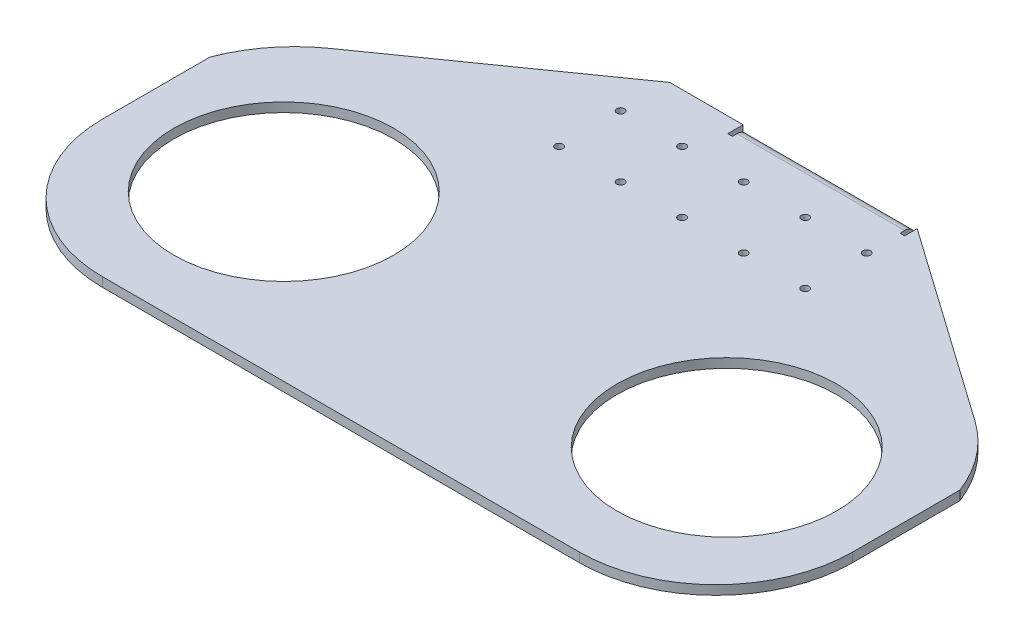
from build123d import *

# Parameters (mm, degrees)
EXTRUDE_1_DEPTH         = 3
SKETCH_2_W              = 1.5
SKETCH_2_H              = 5
CUT_EXTRUDE_1_DEPTH     = 154.658257181
SKETCH_3_W              = 54.5
SKETCH_3_H              = 3
EXTRUDE_2_DEPTH         = 40
HOLE_WIZARD_2_5_2_5_1_D = 2.5
HOLE_WIZARD_2_5_2_5_2_D = 2.5
HOLE_WIZARD_M641_D      = 71.5
FILLET_1_R              = 0.5
FILLET_2_R              = 3
FILLET_3_R              = 3.5
FILLET_4_R              = 44.4


with BuildPart() as part:
    # Эскиз1 → Бобышка-Вытянуть1 (new body)
    with BuildSketch(Plane.XZ.offset(-148.5)):
        with BuildLine():
            Line((121.9, -25.878684783), (121.9, 53.4))
            Line((121.9, 53.4), (-121.9, 53.4))
            Line((-121.9, 53.4), (-121.9, -25.878684783))
            ThreePointArc((-121.9, -25.878684783), (-115.016337378, -38.133733536), (-104.847515108, -47.837654634))
            Line((-104.847515108, -47.837654634), (-40, -93.5))
            Line((-40, -93.5), (39.841624635, -93.5))
            Line((39.841624635, -93.5), (39.841624635, -88.5))
            Line((39.841624635, -88.5), (41.341624635, -88.5))
            Line((41.341624635, -88.5), (41.341624635, -92.555295683))
            Line((41.341624635, -92.555295683), (104.847515108, -47.837654634))
            ThreePointArc((104.847515108, -47.837654634), (115.016337378, -38.133733536), (121.9, -25.878684783))
        make_face()
    extrude(amount=-EXTRUDE_1_DEPTH)

    # Эскиз2 → Вырез-Вытянуть1 (cut, through all)
    with BuildSketch(Plane(origin=(0, 151.5, 0), x_dir=(-1, 0, 0), z_dir=(0, 1, 0))):
        with Locations((15.408375365, -91)):
            Rectangle(SKETCH_2_W, SKETCH_2_H)
    extrude(amount=-CUT_EXTRUDE_1_DEPTH, mode=Mode.SUBTRACT)

    # Эскиз3 → Бобышка-Вытянуть2 (add)
    with BuildSketch(Plane.XZ.offset(-148.5)):
        with Locations((12.591624635, -92)):
            Rectangle(SKETCH_3_W, SKETCH_3_H)
    extrude(amount=EXTRUDE_2_DEPTH)

    # Диаметр отверстия Ø2.5 (2.5)1 (through all)
    with Locations(Plane(origin=(0, 148.5, 0), x_dir=(-1, 0, 0), z_dir=(0, -1, 0))):
        with Locations((40, 57.5), (40, 77.5), (20, 57.5), (20, 77.5), (-40, 57.5), (-40, 77.5), (-20, 57.5), (-20, 77.5), (0, 57.5), (0, 77.5)):
            Hole(HOLE_WIZARD_2_5_2_5_1_D / 2)

    # Диаметр отверстия Ø2.5 (2.5)2 (through all)
    with Locations(Plane.XY.offset(-90.5)):
        with Locations((25, 116.5), (25, 132.5), (0, 116.5), (0, 132.5)):
            Hole(HOLE_WIZARD_2_5_2_5_2_D / 2)

    # Отверстие с зазором M641 (through all)
    with Locations(Plane(origin=(0, 148.5, 0), x_dir=(-1, 0, 0), z_dir=(0, -1, 0))):
        with Locations((72, 0), (-72, 0)):
            Hole(HOLE_WIZARD_M641_D / 2)

    # Скругление1
    fillet_1_edges = [part.edges().sort_by_distance(p)[0] for p in [
        (-40, 150, -93.5),
        (12.591624635, 148.5, -90.5),
    ]]
    fillet(fillet_1_edges, radius=FILLET_1_R)

    # Скругление2
    fillet_2_edges = [part.edges().sort_by_distance(p)[0] for p in [
        (-14.658375365, 108.5, -92),
        (39.841624635, 108.5, -92),
    ]]
    fillet(fillet_2_edges, radius=FILLET_2_R)

    # Скругление3
    fillet_3_edges = [part.edges().sort_by_distance(p)[0] for p in [
        (12.591624635, 151.5, -93.5),
    ]]
    fillet(fillet_3_edges, radius=FILLET_3_R)

    # Скругление4
    fillet_4_edges = [part.edges().sort_by_distance(p)[0] for p in [
        (-121.9, 150, 53.4),
        (121.9, 150, 53.4),
    ]]
    fillet(fillet_4_edges, radius=FILLET_4_R)


solid = part.part
